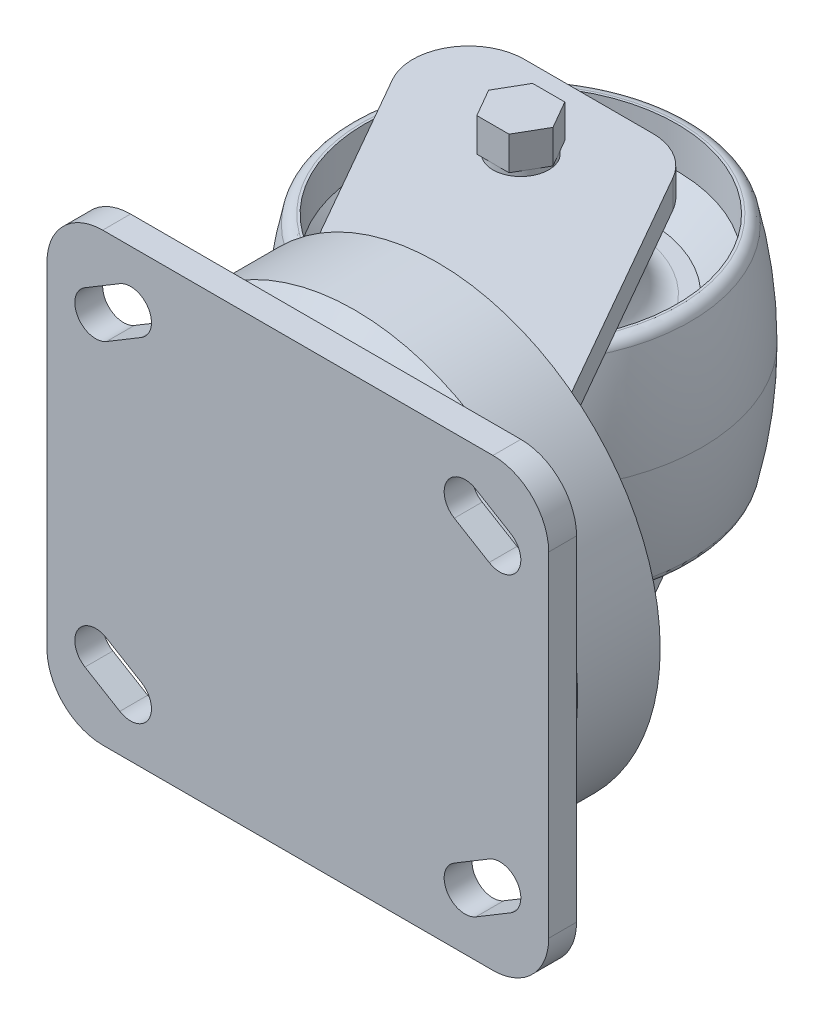
from build123d import *
from build123d.topology import SkipClean

# Parameters (mm, degrees)
FILLET4_R               = 2.54
CHAMFER1_SIZE           = 1.524
EXTRUDE1_DEPTH          = 6.35
FILLET5_R               = 12.7
SKETCH7_W               = 114.3
SKETCH7_H               = 6.35
EXTRUDE2_DEPTH          = 50.8
EXTRUDE8_DEPTH          = 6.35
EXTRUDE3_DEPTH          = 17.526
CHAMFER2_SIZE           = 5.08
EXTRUDE4_DEPTH          = 17.78
CHAMFER3_SIZE           = 5.08
CUT_EXTRUDE1_DEPTH      = 6.35
FILLET1_R               = 12.7
CUT_EXTRUDE2_DEPTH      = 117.521531085
CUT_EXTRUDE2_DEPTH_BACK = 117.521531085
SKETCH11_R              = 6.35
SKETCH12_R              = 6.3246
EXTRUDE5_DEPTH          = 38.5445
EXTRUDE6_DEPTH          = 7.62


with BuildPart() as part:
    # Sketch1 → Revolve1 (revolve)
    with BuildSketch(Plane.XY, mode=Mode.PRIVATE) as revolve1_sk:
        with BuildLine():
            Line((0, 0), (0, -30.1625))
            Line((0, -30.1625), (19.05, -30.1625))
            Line((19.05, -30.1625), (19.05, -15.875))
            ThreePointArc((19.05, -15.875), (20.909871939, -11.384871939), (25.4, -9.525))
            Line((25.4, -9.525), (28.984359697, -9.525))
            Line((28.984359697, -9.525), (35.56, -16.100640303))
            Line((35.56, -16.100640303), (35.56, -25.4))
            Line((35.56, -25.4), (38.1, -25.4))
            ThreePointArc((38.1, -25.4), (40.478173403, -12.798834175), (41.275, 0))
            Line((41.275, 0), (0, 0))
        make_face()
    revolve(revolve1_sk.sketch.rotate(Axis((0, 19.05, 0), (0, -1, 0)), 180), axis=Axis((0, 19.05, 0), (0, -1, 0)))

    # Fillet4
    fillet4_edges = [part.edges().sort_by_distance(p)[0] for p in [
        (38.1, -25.4, 0),
    ]]
    fillet(fillet4_edges, radius=FILLET4_R)

    # Chamfer1
    chamfer1_edges = [part.edges().sort_by_distance(p)[0] for p in [
        (19.05, -30.1625, 0),
    ]]
    chamfer(chamfer1_edges, length=CHAMFER1_SIZE)


with BuildPart() as body_2:
    # Sketch3 → Extrude1 (new body)
    with BuildSketch(Plane.XZ.offset(30.9245)):
        Polygon((-40.140192401, -19.05), (-3.854478115, 44.45), (54.654478115, 44.45), (18.36876383, -19.05), align=None)
    extrude(amount=EXTRUDE1_DEPTH)

    # Fillet5
    fillet5_edges = [body_2.edges().sort_by_distance(p)[0] for p in [
        (-40.140192401, -34.0995, -19.05),
        (18.36876383, -34.0995, -19.05),
    ]]
    fillet(fillet5_edges, radius=FILLET5_R)

    # Sketch20 → Extrude8 (add)
    with BuildSketch(Plane.XY.offset(44.45)):
        with BuildLine():
            Line((-25.4, 0), (76.2, 0))
            ThreePointArc((76.2, 0), (25.4, -50.8), (-25.4, 0))
        make_face()
    extrude(amount=EXTRUDE8_DEPTH)

    # Sketch8 → Extrude3 (add)
    with BuildSketch(Plane.XY.offset(50.8)):
        with BuildLine():
            Line((-25.4, 0), (-6.35, 0))
            ThreePointArc((-6.35, 0), (25.4, -31.75), (57.15, 0))
            Line((57.15, 0), (76.2, 0))
            ThreePointArc((76.2, 0), (25.4, -50.8), (-25.4, 0))
        make_face()
    extrude(amount=EXTRUDE3_DEPTH)

    # Chamfer2
    chamfer2_edges = [body_2.edges().sort_by_distance(p)[0] for p in [
        (25.4, -50.8, 68.326),
    ]]
    chamfer(chamfer2_edges, length=CHAMFER2_SIZE)


with BuildPart() as body_3:
    # Sketch7 → Extrude2 (new body)
    with BuildSketch(Plane(origin=(0, 0, 0), x_dir=(1, 0, 0), z_dir=(0, 1, 0))):
        with Locations((25.4, -73.025)):
            Rectangle(SKETCH7_W, SKETCH7_H)
    extrude(amount=-EXTRUDE2_DEPTH)

    # Sketch9 → Extrude4 (add)
    with BuildSketch(Plane(origin=(0, 0, 69.85), x_dir=(-1, 0, 0), z_dir=(0, 0, -1))):
        with BuildLine():
            Line((-50.8, 0), (-31.75, 0))
            ThreePointArc((-31.75, 0), (-25.4, -6.35), (-19.05, 0))
            Line((-19.05, 0), (0, 0))
            ThreePointArc((0, 0), (-25.4, -25.4), (-50.8, 0))
        make_face()
    extrude(amount=EXTRUDE4_DEPTH)

    # Chamfer3
    chamfer3_edges = [body_3.edges().sort_by_distance(p)[0] for p in [
        (25.4, -6.35, 69.85),
    ]]
    chamfer(chamfer3_edges, length=CHAMFER3_SIZE)

    # Sketch10 → Cut-Extrude1 (cut)
    with BuildSketch(Plane.XY.offset(76.2)):
        with BuildLine():
            Line((-18.187213965, -29.253689941), (-10.249713965, -34.016189941))
            ThreePointArc((-10.249713965, -34.016189941), (-8.616189941, -40.550286035), (-15.150286035, -42.183810059))
            Line((-15.150286035, -42.183810059), (-23.087786035, -37.421310059))
            ThreePointArc((-23.087786035, -37.421310059), (-24.721310059, -30.887213965), (-18.187213965, -29.253689941))
        make_face()
        with BuildLine():
            Line((65.950286035, -42.183810059), (73.887786035, -37.421310059))
            ThreePointArc((73.887786035, -37.421310059), (75.521310059, -30.887213965), (68.987213965, -29.253689941))
            Line((68.987213965, -29.253689941), (61.049713965, -34.016189941))
            ThreePointArc((61.049713965, -34.016189941), (59.416189941, -40.550286035), (65.950286035, -42.183810059))
        make_face()
    extrude(amount=-CUT_EXTRUDE1_DEPTH, mode=Mode.SUBTRACT)

    # Fillet1
    fillet1_edges = [body_3.edges().sort_by_distance(p)[0] for p in [
        (82.55, -50.8, 73.025),
        (-31.75, -50.8, 73.025),
    ]]
    fillet(fillet1_edges, radius=FILLET1_R)

    # Mirror1: body 3 across plane


with BuildPart() as cut_extrude2_tool:
    # Sketch11 → Cut-Extrude2 (new, two sides: drawn at the far end of the back side and taken through both)
    with BuildSketch(Plane(origin=(0, -30.9245, 0), x_dir=(-1, 0, 0), z_dir=(0, 1, 0)).offset(-CUT_EXTRUDE2_DEPTH_BACK)):
        Circle(SKETCH11_R)
    extrude(amount=CUT_EXTRUDE2_DEPTH + CUT_EXTRUDE2_DEPTH_BACK)


with BuildPart() as part_1:
    add(part.part)

    # Cut-Extrude2: cut by cut_extrude2_tool
    add(cut_extrude2_tool.part, mode=Mode.SUBTRACT)

    # Mirror1 2: part across plane


with BuildPart() as body_2_1:
    add(body_2.part)

    # Cut-Extrude2: cut by cut_extrude2_tool
    add(cut_extrude2_tool.part, mode=Mode.SUBTRACT)

    # Mirror1 3: body 2 across plane


with BuildPart() as body_4:
    # Sketch12 → Extrude5 (new body)
    with BuildSketch(Plane(origin=(0, 0, 0), x_dir=(-1, 0, 0), z_dir=(0, 1, 0))):
        with Locations(Location((0, 0, 0), (0, 0, 90))):
            Circle(SKETCH12_R)
    extrude(amount=-EXTRUDE5_DEPTH)

    # Sketch13 → Extrude6 (add)
    with BuildSketch(Plane.XZ.offset(38.5445)):
        Polygon((3.666174209, 6.35), (-3.666174209, 6.35), (-7.332348419, 0), (-3.666174209, -6.35), (3.666174209, -6.35), (7.332348419, 0), align=None)
    extrude(amount=EXTRUDE6_DEPTH)

    # Mirror1 4: body 4 across plane


with BuildPart() as body_3_1:
    add(body_3.part)
    add(body_3.part.mirror(Plane.ZX))


with BuildPart() as part_2:
    add(part_1.part)
    add(part_1.part.mirror(Plane.ZX))


with BuildPart() as body_2_2:
    with SkipClean():  # the faces are left unmerged after this step: merging them gives an invalid solid
        add(body_2_1.part)
        add(body_2_1.part.mirror(Plane.ZX))


with BuildPart() as body_4_1:
    add(body_4.part)
    add(body_4.part.mirror(Plane.ZX))


solid = Compound([body_3_1.part, part_2.part, body_2_2.part, body_4_1.part])
